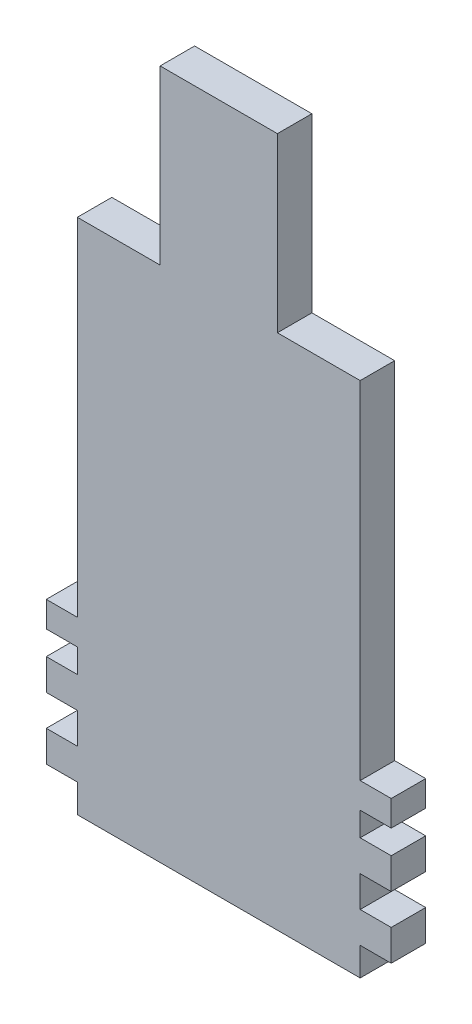
from build123d import *

# Parameters (mm, degrees)
BOSS_EXTRU_1_DEPTH = 5


with BuildPart() as part:
    # Esquisse1 → Boss.-Extru.1 (new body)
    with BuildSketch(Plane.XY):
        Polygon((-47.921426264, 34.78020521), (-47.921426264, 38.88020521), (-43.421426264, 38.88020521), (-43.421426264, 43.38020521), (-47.921426264, 43.38020521), (-47.921426264, 47.88020521), (-43.421426264, 47.88020521), (-43.421426264, 52.38020521), (-47.921426264, 52.38020521), (-47.921426264, 55.84431721), (-43.421426264, 55.84431721), (-43.421426264, 59.56508121), (-47.921426264, 59.56508121), (-47.921426264, 109.78020521), (-59.921426264, 109.78020521), (-59.921426264, 134.78020521), (-76.921426264, 134.78020521), (-76.921426264, 109.78020521), (-88.921426264, 109.78020521), (-88.921426264, 59.56508121), (-93.421426264, 59.56508121), (-93.421426264, 55.84431721), (-88.921426264, 55.84431721), (-88.921426264, 52.38020521), (-93.421426264, 52.38020521), (-93.421426264, 47.88020521), (-88.921426264, 47.88020521), (-88.921426264, 43.38020521), (-93.421426264, 43.38020521), (-93.421426264, 38.88020521), (-88.921426264, 38.88020521), (-88.921426264, 34.78020521), align=None)
    extrude(amount=BOSS_EXTRU_1_DEPTH)


solid = part.part
